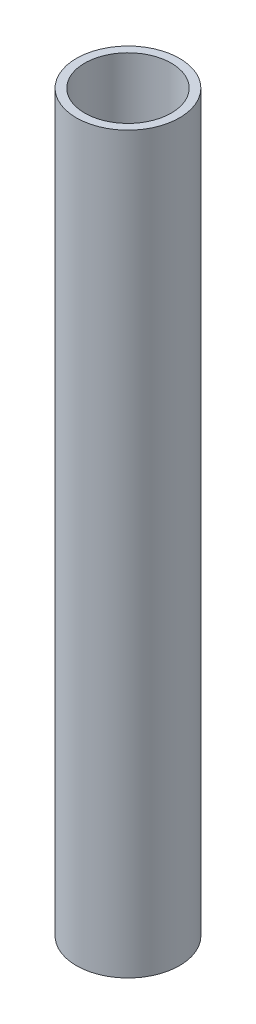
from build123d import *

# Parameters (mm, degrees)
CROQUIS1_R              = 12.5
CROQUIS1_R_2            = 10.5
SALIENTE_EXTRUIR1_DEPTH = 178


with BuildPart() as part:
    # Croquis1 → Saliente-Extruir1 (new body)
    with BuildSketch(Plane(origin=(0, 0, 0), x_dir=(1, 0, 0), z_dir=(0, 1, 0))):
        with Locations(Location((0, 0, 0), (0, 0, 270))):
            Circle(CROQUIS1_R)
        with Locations(Location((0, 0, 0), (0, 0, 270))):
            Circle(CROQUIS1_R_2, mode=Mode.SUBTRACT)
    extrude(amount=SALIENTE_EXTRUIR1_DEPTH)


solid = part.part
